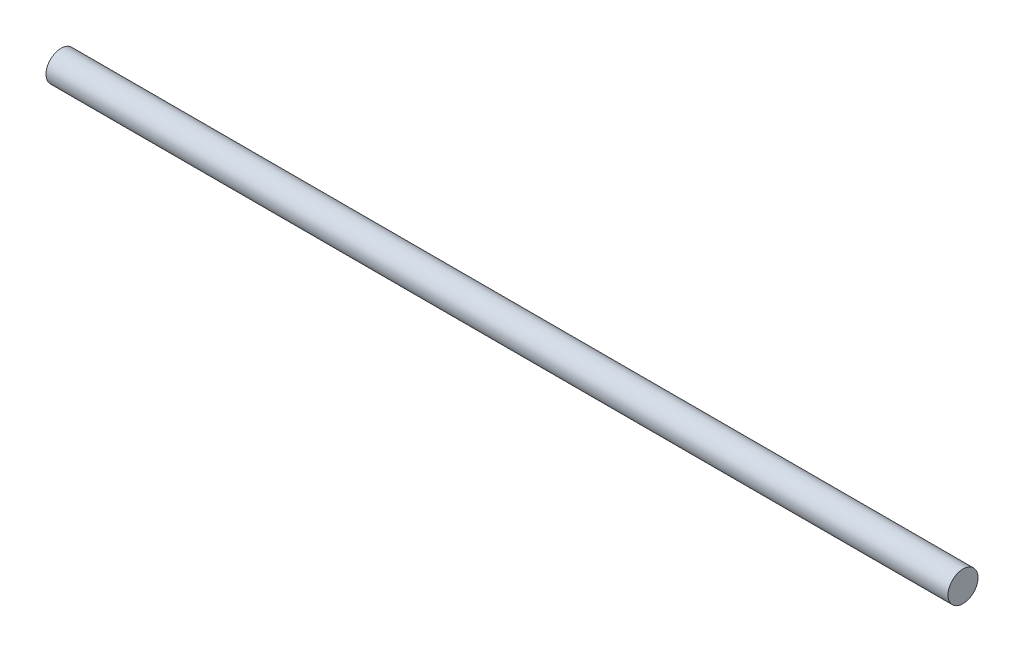
from build123d import *

# Parameters (mm, degrees)
SKETCH2_R           = 1.5
BOSS_EXTRUDE1_DEPTH = 90


with BuildPart() as part:
    # Sketch2 → Boss-Extrude1 (new body)
    with BuildSketch(Plane(origin=(0, 0, 0), x_dir=(0, 0, -1), z_dir=(1, 0, 0))):
        with Locations(Location((0, 0, 0), (0, 0, 180))):
            Circle(SKETCH2_R)
    extrude(amount=BOSS_EXTRUDE1_DEPTH)


solid = part.part
